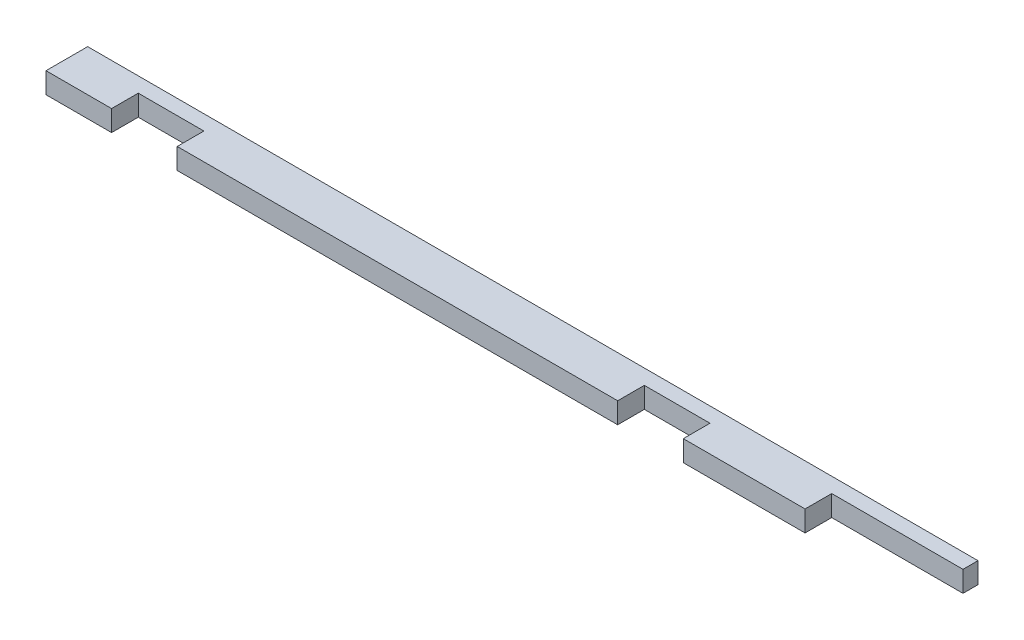
from build123d import *

# Parameters (mm, degrees)
BOSS_EXTRUDE1_DEPTH = 1.5875


with BuildPart() as part:
    # Sketch1 → Boss-Extrude1 (new body)
    with BuildSketch(Plane(origin=(0, 0, 0), x_dir=(1, 0, 0), z_dir=(0, 1, 0))):
        Polygon((0, 0), (4.996382968, 0), (4.996382968, 2.032), (9.995102968, 2.032), (9.995102968, 0), (19.275630486, 0), (29.275630486, 0), (43.551260812, 0), (43.551260812, 2.032), (48.551260718, 2.032), (48.551260718, 0), (57.826891138, 0), (57.826891138, 2.032), (67.826891138, 2.032), (67.826891138, 3.175), (0, 3.175), align=None)
    extrude(amount=BOSS_EXTRUDE1_DEPTH)


solid = part.part
